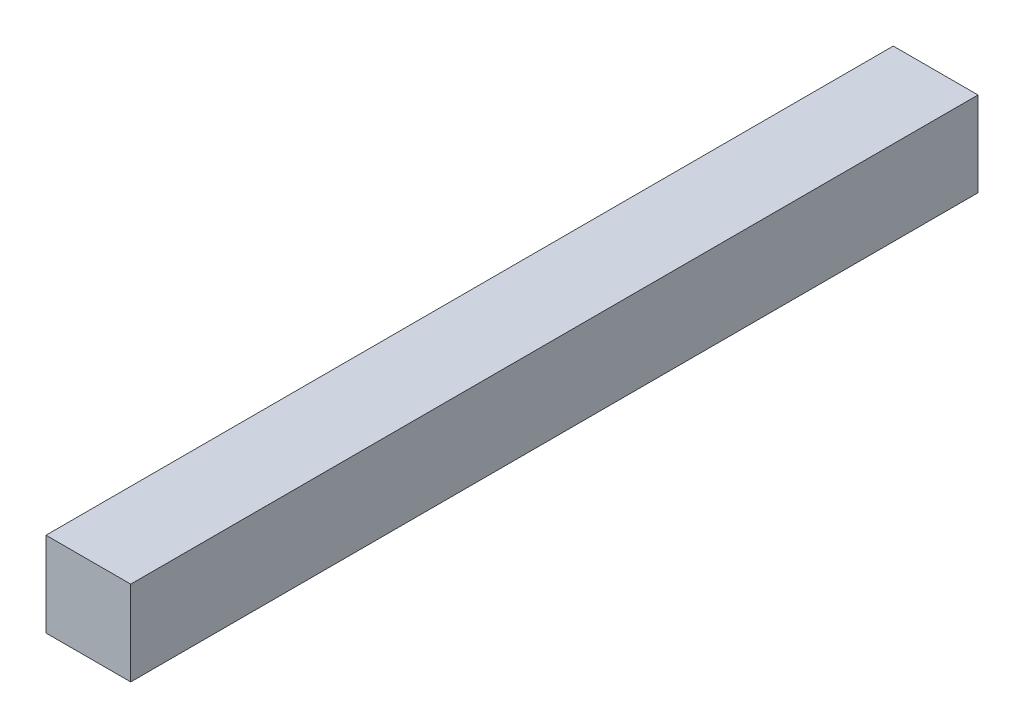
from build123d import *

# Parameters (mm, degrees)
SKETCH1_W      = 1000
SKETCH1_H      = 1000
EXTRUDE1_DEPTH = 10000


with BuildPart() as part:
    # Sketch1 → Extrude1 (new body)
    with BuildSketch(Plane.XY):
        with Locations((500, 500)):
            Rectangle(SKETCH1_W, SKETCH1_H)
    extrude(amount=EXTRUDE1_DEPTH)


solid = part.part
